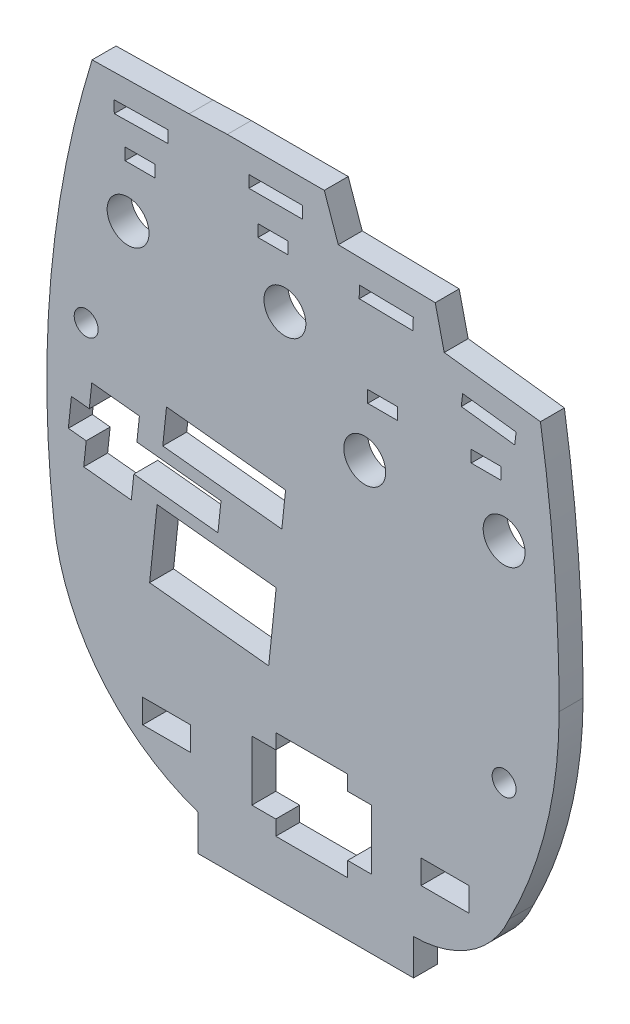
from build123d import *

# Parameters (mm, degrees)
SKETCH1_R           = 2
SKETCH1_R_2         = 3.5
SKETCH1_W           = 9.000072
SKETCH1_H           = 2
SKETCH1_W_2         = 5
BOSS_EXTRUDE1_DEPTH = 4
SKETCH2_W           = 8
SKETCH2_H           = 4
CUT_EXTRUDE1_DEPTH  = 96.21167482


with BuildPart() as part:
    # Sketch1 → Boss-Extrude1 (new body)
    with BuildSketch(Plane.XY):
        with BuildLine():
            Line((-12.978640908, -18), (-12.978640908, -24))
            Line((-12.978640908, -24), (23.021359092, -24))
            Line((23.021359092, -24), (23.021359092, -18))
            ThreePointArc((23.021359092, -18), (32.58126188, -15.140073441), (39, -7.5))
            ThreePointArc((39, -7.5), (45.227131985, 9.097629123), (47.343034567, 26.698237678))
            ThreePointArc((47.343034567, 26.698237678), (46.561018226, 46.955835458), (44.219623828, 67.092858318))
            Line((44.219623828, 67.092858318), (28.140376172, 69.067141682))
            Line((28.140376172, 69.067141682), (26.638766331, 75.523635508))
            Line((26.638766331, 75.523635508), (10.441233669, 75.806364492))
            Line((10.441233669, 75.806364492), (8.1, 82.51))
            Line((8.1, 82.51), (-8.1, 82.51))
            Line((-8.1, 82.51), (-14.491217975, 82.280462515))
            Line((-14.491217975, 82.280462515), (-30.688782025, 81.999537485))
            ThreePointArc((-30.688782025, 81.999537485), (-37.567707395, 47.245827753), (-37.052658257, 11.821617405))
            ThreePointArc((-37.052658257, 11.821617405), (-29.300451665, -6.548172019), (-12.978640908, -18))
        make_face()
        with Locations((38.147341743, 11.821617405)):
            Circle(SKETCH1_R, mode=Mode.SUBTRACT)
        with Locations((-24.678960076, 61.651218734)):
            Circle(SKETCH1_R_2, mode=Mode.SUBTRACT)
        with Locations((1.521420673, 61.651218734)):
            Circle(SKETCH1_R_2, mode=Mode.SUBTRACT)
        with Locations((14.86306514, 46.821617405)):
            Circle(SKETCH1_R_2, mode=Mode.SUBTRACT)
        with Locations((38.147341743, 46.821617405)):
            Circle(SKETCH1_R_2, mode=Mode.SUBTRACT)
        with Locations((-31.681501662, 43.456405989)):
            Circle(SKETCH1_R, mode=Mode.SUBTRACT)
        with Locations((0, 77.51)):
            Rectangle(SKETCH1_W, SKETCH1_H, mode=Mode.SUBTRACT)
        Polygon((-4, -2.5), (0, -2.5), (0, 0), (12, 0), (12, -2.5), (16, -2.5), (16, -12.5), (12, -12.5), (12, -15), (0, -15), (0, -12.5), (-4, -12.5), align=None, mode=Mode.SUBTRACT)
        with Locations((35.147341743, 56.321617405)):
            Rectangle(SKETCH1_W_2, SKETCH1_H, mode=Mode.SUBTRACT)
        Polygon((-27.019995137, 78.062566115), (-18.021276454, 78.218636824), (-17.986594351, 76.218937559), (-26.985313034, 76.062866849), align=None, mode=Mode.SUBTRACT)
        with Locations((17.86306514, 56.321617405)):
            Rectangle(SKETCH1_W_2, SKETCH1_H, mode=Mode.SUBTRACT)
        with Locations((-0.478579327, 71.151218734)):
            Rectangle(SKETCH1_W_2, SKETCH1_H, mode=Mode.SUBTRACT)
        Polygon((13.970839752, 71.744145677), (13.935934939, 69.744450286), (22.934636184, 69.587377372), (22.969540997, 71.587072762), align=None, mode=Mode.SUBTRACT)
        Polygon((40.15901604, 63.561398961), (31.226029212, 64.658231826), (30.982290526, 62.673139523), (39.915277354, 61.576306658), align=None, mode=Mode.SUBTRACT)
        Polygon((1.632632483, 35.912105076), (1.005748572, 29.944943559), (-18.884789816, 32.034556594), (-18.257905905, 38.00171811), align=None, mode=Mode.SUBTRACT)
        with Locations((-22.678960076, 71.151218734)):
            Rectangle(SKETCH1_W_2, SKETCH1_H, mode=Mode.SUBTRACT)
        Polygon((0.065422707, 20.994201285), (-1.188345114, 9.059878252), (-21.078883502, 11.149491286), (-19.825115681, 23.083814319), align=None, mode=Mode.SUBTRACT)
        Polygon((-9.666, 24.072796069), (-9.153, 28.955923243), (-23.205665371, 30.432234852), (-22.787742764, 34.410342529), (-30.743958119, 35.246187743), (-31.161880726, 31.268080066), (-34.143965433, 31.581364852), (-34.656965433, 26.698237678), (-31.674880726, 26.384952891), (-32.092803333, 22.406845214), (-24.136587978, 21.571), (-23.718665371, 25.549107678), align=None, mode=Mode.SUBTRACT)
    extrude(amount=BOSS_EXTRUDE1_DEPTH)

    # Sketch2 → Cut-Extrude1 (cut, through all)
    with BuildSketch(Plane(origin=(0, 0, 0), x_dir=(-1, 0, 0), z_dir=(0, 0, -1))):
        with Locations((-28.271359092, -8)):
            Rectangle(SKETCH2_W, SKETCH2_H)
        with Locations((18.228640908, -8)):
            Rectangle(SKETCH2_W, SKETCH2_H)
    extrude(amount=-CUT_EXTRUDE1_DEPTH, mode=Mode.SUBTRACT)


solid = part.part
